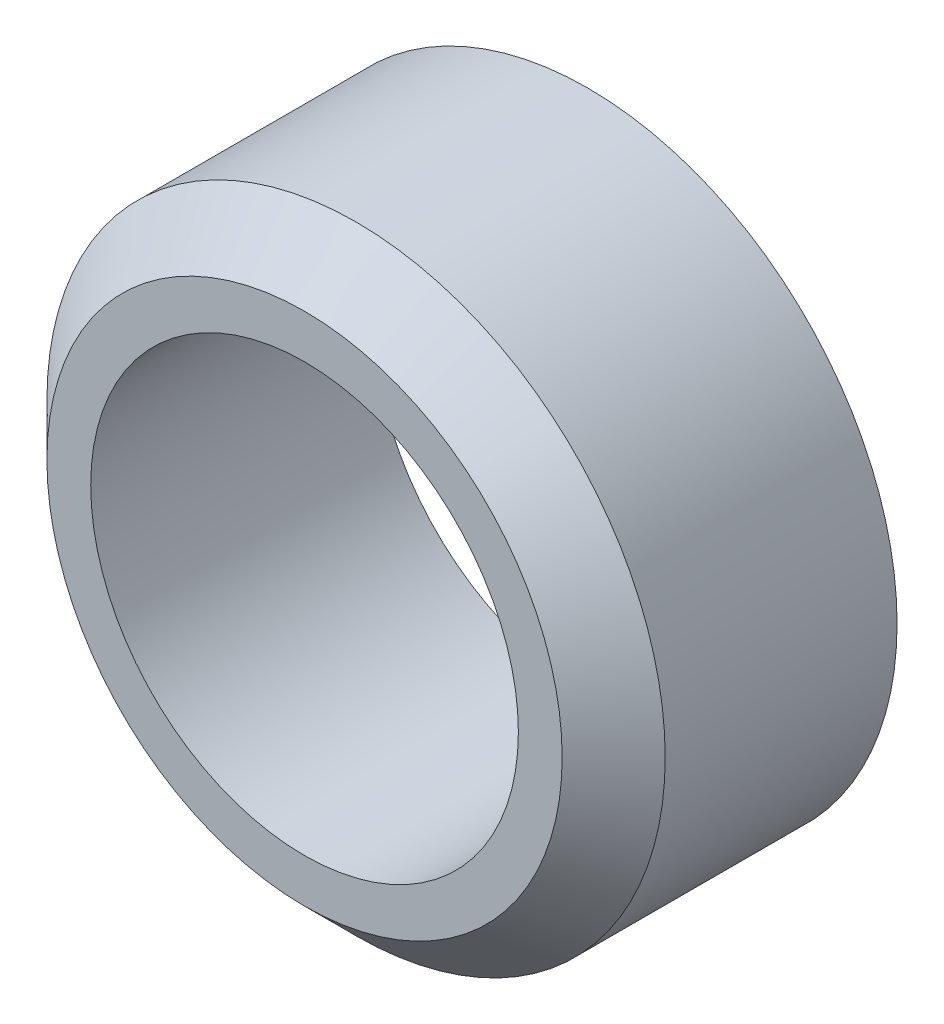
from build123d import *

# Parameters (mm, degrees)
SKETCH_1_R      = 6
SKETCH_1_R_2    = 4.15
EXTRUDE_1_DEPTH = 5.5
CHAMFER_1_SIZE  = 1


with BuildPart() as part:
    # ｽｹｯﾁ1 → ﾎﾞｽ - 押し出し1 (new body)
    with BuildSketch(Plane.XY):
        Circle(SKETCH_1_R)
        Circle(SKETCH_1_R_2, mode=Mode.SUBTRACT)
    extrude(amount=EXTRUDE_1_DEPTH)

    # 面取り1
    chamfer_1_edges = [part.edges().sort_by_distance(p)[0] for p in [
        (-6, 0, 5.5),
    ]]
    chamfer(chamfer_1_edges, length=CHAMFER_1_SIZE)


solid = part.part
